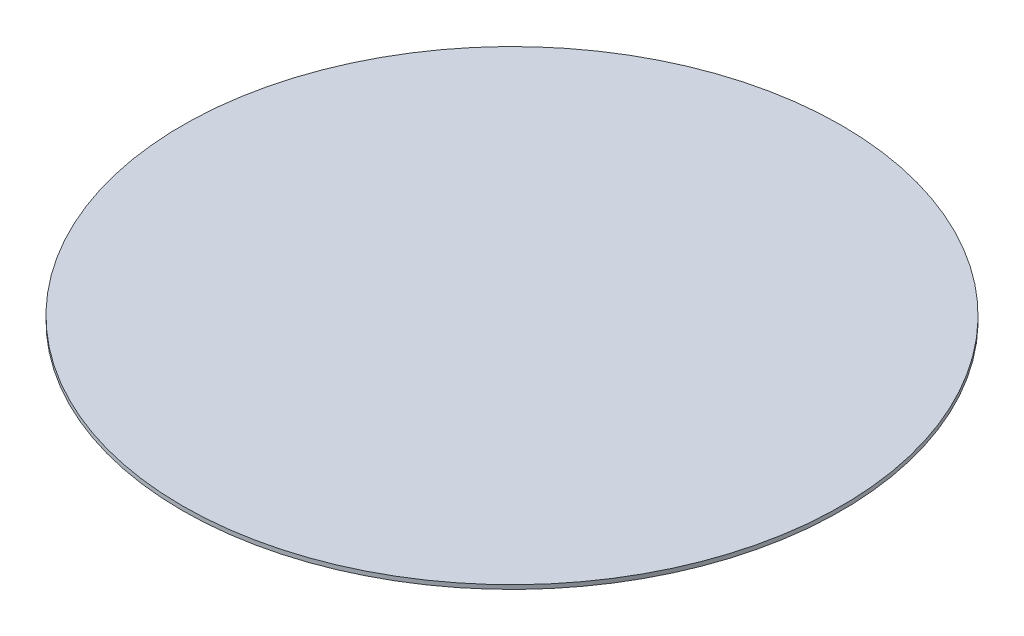
from build123d import *

# Parameters (mm, degrees)
SKETCH1_R           = 80
BOSS_EXTRUDE1_DEPTH = 1


with BuildPart() as part:
    # Sketch1 → Boss-Extrude1 (new body)
    with BuildSketch(Plane(origin=(0, 0, 0), x_dir=(1, 0, 0), z_dir=(0, 1, 0))):
        with Locations(Location((0, 0, 0), (0, 0, 270))):
            Circle(SKETCH1_R)
    extrude(amount=BOSS_EXTRUDE1_DEPTH)


solid = part.part
